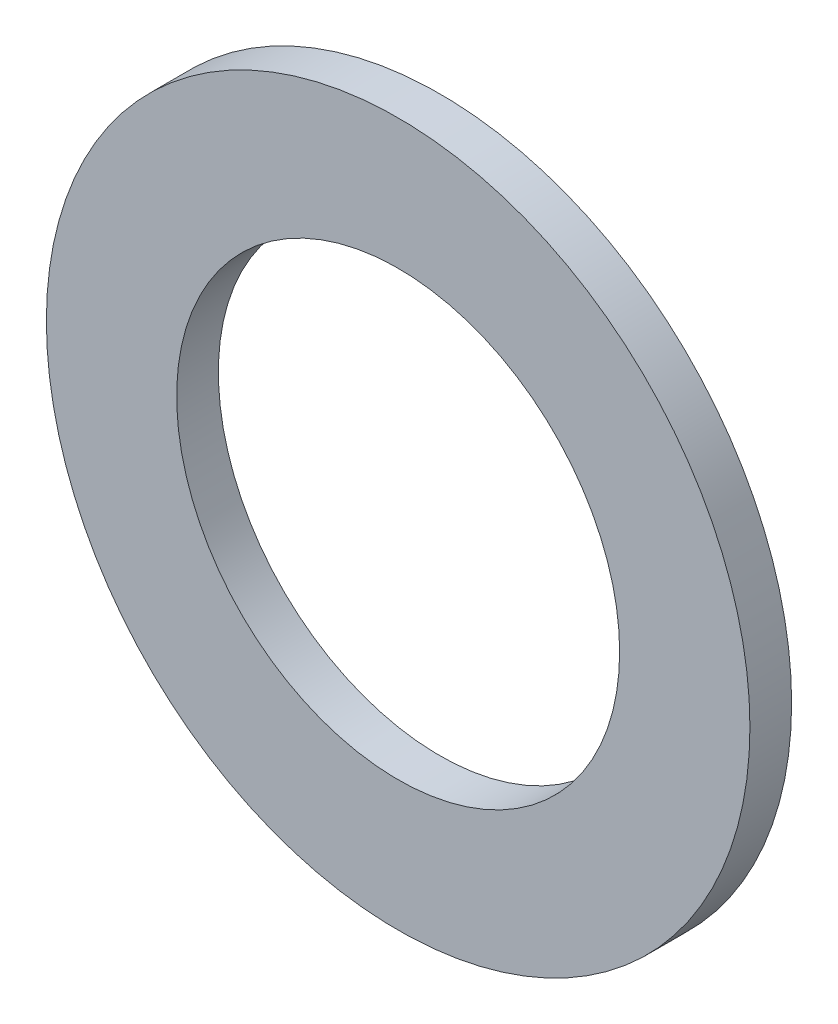
from build123d import *

# Parameters (mm, degrees)
BASES_R    = 6.75
BASES_R_2  = 4.25
BASE_DEPTH = 0.4


with BuildPart() as part:
    # BaseS → BASE (new, symmetric)
    with BuildSketch(Plane.XY):
        Circle(BASES_R)
        Circle(BASES_R_2, mode=Mode.SUBTRACT)
    extrude(amount=BASE_DEPTH, both=True)


solid = part.part
